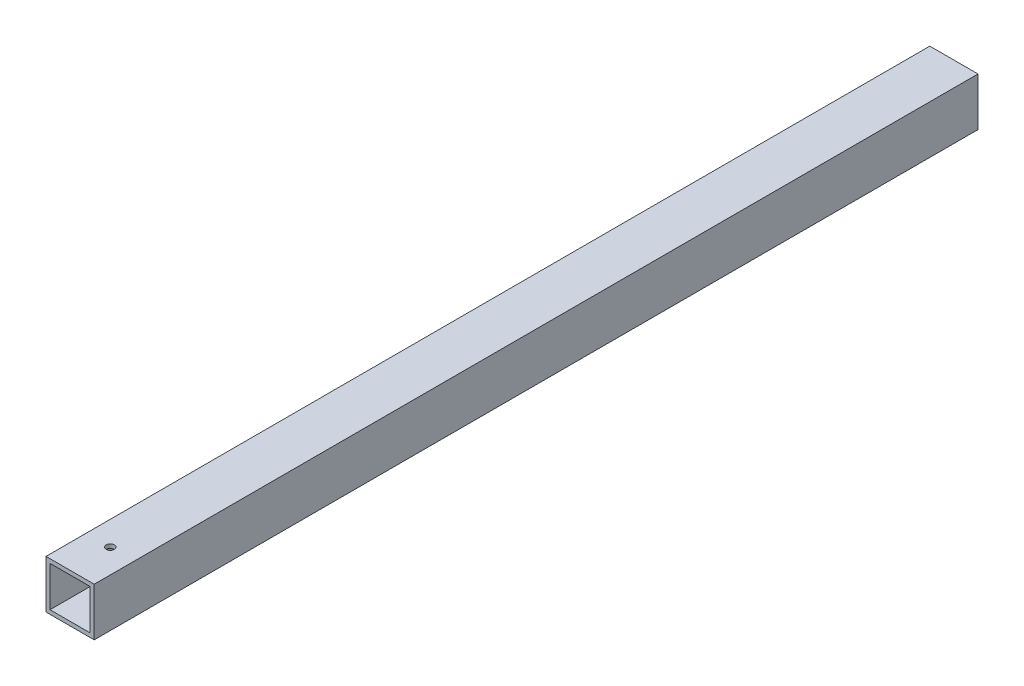
from build123d import *

# Parameters (mm, degrees)
SKETCH_1_W          = 12
SKETCH_1_H          = 12
SKETCH_1_W_2        = 10
SKETCH_1_H_2        = 10
EXTRUDE_1_DEPTH     = 220.00227405
SKETCH_2_R          = 1
CUT_EXTRUDE_1_DEPTH = 12


with BuildPart() as part:
    # 草图1 → 凸台-拉伸1 (new body)
    with BuildSketch(Plane.XY):
        with Locations((6, 6)):
            Rectangle(SKETCH_1_W, SKETCH_1_H)
        with Locations((6, 6)):
            Rectangle(SKETCH_1_W_2, SKETCH_1_H_2, mode=Mode.SUBTRACT)
    extrude(amount=EXTRUDE_1_DEPTH)

    # 草图2 → 切除-拉伸1 (cut)
    with BuildSketch(Plane.XZ):
        with Locations(Location((6, 210.00227405, 0), (0, 0, 270))):
            Circle(SKETCH_2_R)
    extrude(amount=-CUT_EXTRUDE_1_DEPTH, mode=Mode.SUBTRACT)


solid = part.part
